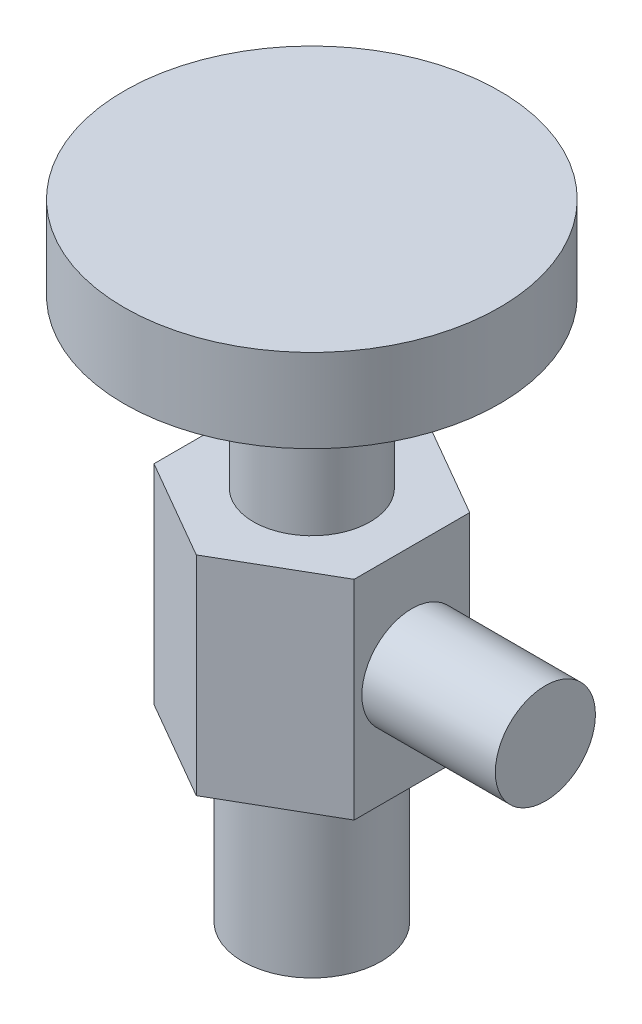
from build123d import *

# Parameters (mm, degrees)
SKETCH1_R           = 8.3
BOSS_EXTRUDE1_DEPTH = 20
BOSS_EXTRUDE2_DEPTH = 25
SKETCH3_R           = 7
BOSS_EXTRUDE3_DEPTH = 20
SKETCH4_R           = 22.5
BOSS_EXTRUDE4_DEPTH = 10
SKETCH5_R           = 6
BOSS_EXTRUDE5_DEPTH = 28


with BuildPart() as part:
    # Sketch1 → Boss-Extrude1 (new body)
    with BuildSketch(Plane(origin=(0, 0, 0), x_dir=(1, 0, 0), z_dir=(0, 1, 0))):
        with Locations(Location((0, 0, 0), (0, 0, 270))):
            Circle(SKETCH1_R)
    extrude(amount=-BOSS_EXTRUDE1_DEPTH)

    # Sketch2 → Boss-Extrude2 (add)
    with BuildSketch(Plane(origin=(0, 0, 0), x_dir=(1, 0, 0), z_dir=(0, 1, 0))):
        Polygon((0, 13.856406461), (-12, 6.92820323), (-12, -6.92820323), (0, -13.856406461), (12, -6.92820323), (12, 6.92820323), align=None)
    extrude(amount=BOSS_EXTRUDE2_DEPTH)

    # Sketch3 → Boss-Extrude3 (add)
    with BuildSketch(Plane(origin=(0, 25, 0), x_dir=(1, 0, 0), z_dir=(0, 1, 0))):
        with Locations(Location((0, 0, 0), (0, 0, 270))):
            Circle(SKETCH3_R)
    extrude(amount=BOSS_EXTRUDE3_DEPTH)

    # Sketch4 → Boss-Extrude4 (add)
    with BuildSketch(Plane(origin=(0, 45, 0), x_dir=(1, 0, 0), z_dir=(0, 1, 0))):
        with Locations(Location((0, 0, 0), (0, 0, 270))):
            Circle(SKETCH4_R)
    extrude(amount=BOSS_EXTRUDE4_DEPTH)

    # Sketch5 → Boss-Extrude5 (add)
    with BuildSketch(Plane(origin=(0, 0, 0), x_dir=(0, 0, -1), z_dir=(1, 0, 0))):
        with Locations(Location((0, 12.5, 0), (0, 0, 180))):
            Circle(SKETCH5_R)
    extrude(amount=BOSS_EXTRUDE5_DEPTH)


solid = part.part
